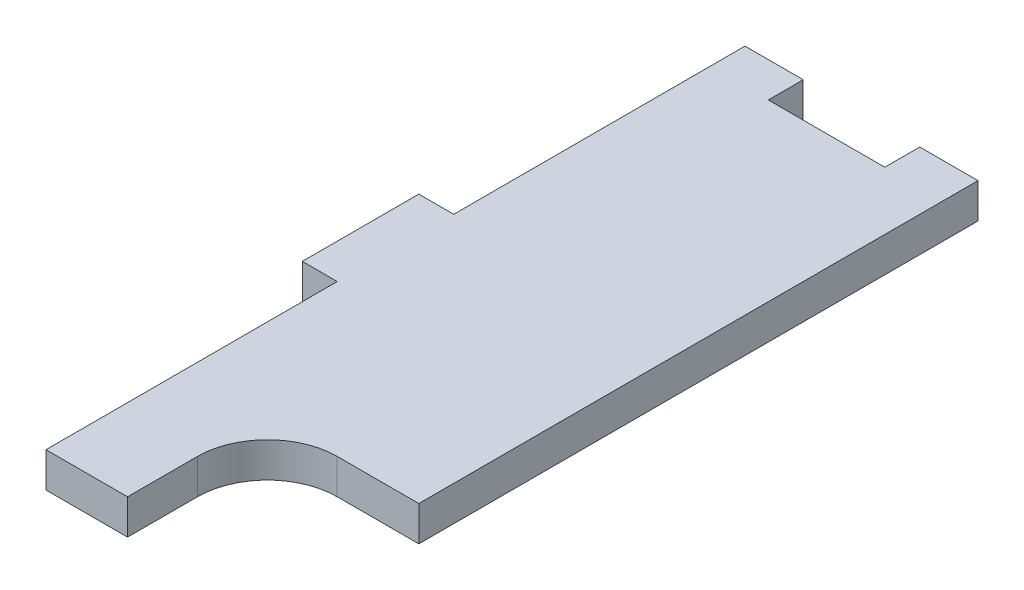
from build123d import *

# Parameters (mm, degrees)
BOSS_EXTRUDE1_DEPTH = 3


with BuildPart() as part:
    # Sketch1 → Boss-Extrude1 (new body)
    with BuildSketch(Plane(origin=(0, 0, 0), x_dir=(1, 0, 0), z_dir=(0, 1, 0))):
        with BuildLine():
            Line((-3, -24), (-3, -30))
            Line((-3, -30), (-10, -30))
            Line((-10, -30), (-10, -5))
            Line((-10, -5), (-13, -5))
            Line((-13, -5), (-13, 5))
            Line((-13, 5), (-10, 5))
            Line((-10, 5), (-10, 30))
            Line((-10, 30), (-5, 30))
            Line((-5, 30), (-5, 27))
            Line((-5, 27), (5, 27))
            Line((5, 27), (5, 30))
            Line((5, 30), (10, 30))
            Line((10, 30), (10, -18))
            Line((10, -18), (3, -18))
            ThreePointArc((3, -18), (-1.242640687, -19.757359313), (-3, -24))
        make_face()
    extrude(amount=BOSS_EXTRUDE1_DEPTH)


solid = part.part
